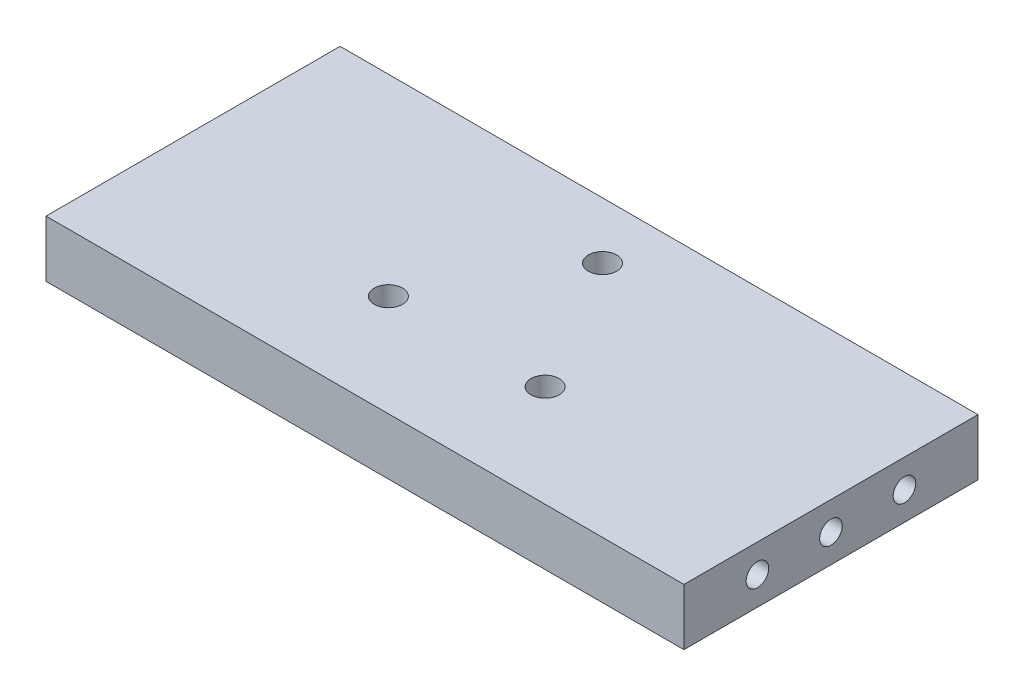
from build123d import *

# Parameters (mm, degrees)
SKETCH1_W                 = 56.4
SKETCH1_H                 = 26
BOSS_EXTRUDE1_DEPTH       = 5
F_2_0MM_DOWEL_HOLE1_D     = 2
F_2_0MM_DOWEL_HOLE1_DEPTH = 7
F_2_0MM_DOWEL_HOLE1_TIP   = 0.600860619
F_2_0MM_DOWEL_HOLE2_D     = 2
F_2_0MM_DOWEL_HOLE2_DEPTH = 7
F_2_0MM_DOWEL_HOLE2_TIP   = 0.600860619
F_2_5MM_DOWEL_HOLE1_D     = 2.5
F_2_5MM_DOWEL_HOLE1_DEPTH = 8
F_2_5MM_DOWEL_HOLE1_TIP   = 0.751075774


with BuildPart() as part:
    # Sketch1 → Boss-Extrude1 (new body)
    with BuildSketch(Plane(origin=(0, 0, 0), x_dir=(1, 0, 0), z_dir=(0, 1, 0))):
        with Locations((28.2, 13)):
            Rectangle(SKETCH1_W, SKETCH1_H)
    extrude(amount=BOSS_EXTRUDE1_DEPTH)

    # Ø2.0mm Dowel Hole1
    with Locations(Plane(origin=(56.4, 0, 0), x_dir=(0, 0, -1), z_dir=(1, 0, 0))):
        with Locations((6.5, 2.5), (13, 2.5), (19.5, 2.5)):
            Hole(F_2_0MM_DOWEL_HOLE1_D / 2, depth=F_2_0MM_DOWEL_HOLE1_DEPTH)
            with Locations((0, 0, -(F_2_0MM_DOWEL_HOLE1_DEPTH + F_2_0MM_DOWEL_HOLE1_TIP / 2))):  # 118° drill point
                Cone(0, F_2_0MM_DOWEL_HOLE1_D / 2, F_2_0MM_DOWEL_HOLE1_TIP, mode=Mode.SUBTRACT)

    # Ø2.0mm Dowel Hole2
    with Locations(Plane.ZY):
        with Locations((-19.5, 2.5), (-13, 2.5), (-6.5, 2.5)):
            Hole(F_2_0MM_DOWEL_HOLE2_D / 2, depth=F_2_0MM_DOWEL_HOLE2_DEPTH)
            with Locations((0, 0, -(F_2_0MM_DOWEL_HOLE2_DEPTH + F_2_0MM_DOWEL_HOLE2_TIP / 2))):  # 118° drill point
                Cone(0, F_2_0MM_DOWEL_HOLE2_D / 2, F_2_0MM_DOWEL_HOLE2_TIP, mode=Mode.SUBTRACT)

    # Ø2.5mm Dowel Hole1
    with Locations(Plane(origin=(21.27179677, 5, -9), x_dir=(0, 0, 1), z_dir=(0, 1, 0))):
        with Locations((0, 0), (-12, 6.92820323), (0, 13.85640646)):
            Hole(F_2_5MM_DOWEL_HOLE1_D / 2, depth=F_2_5MM_DOWEL_HOLE1_DEPTH)
            with Locations((0, 0, -(F_2_5MM_DOWEL_HOLE1_DEPTH + F_2_5MM_DOWEL_HOLE1_TIP / 2))):  # 118° drill point
                Cone(0, F_2_5MM_DOWEL_HOLE1_D / 2, F_2_5MM_DOWEL_HOLE1_TIP, mode=Mode.SUBTRACT)


solid = part.part
